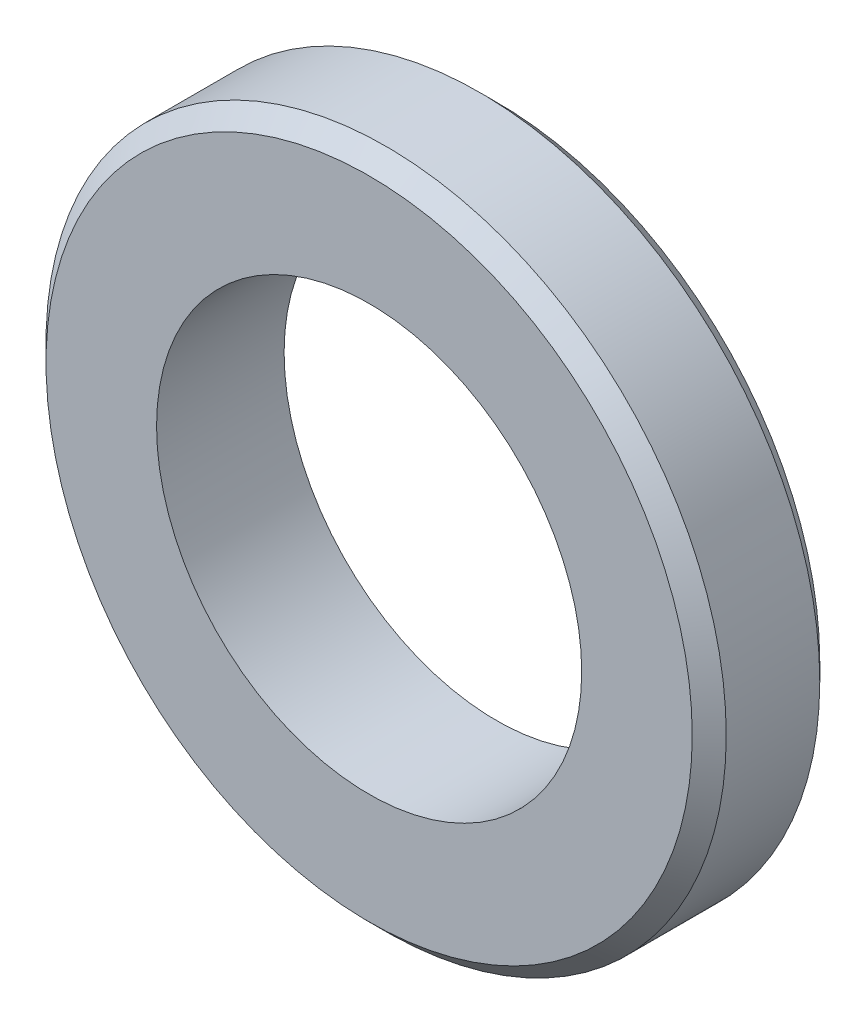
from build123d import *

# Parameters (mm, degrees)
SKETCH1_R           = 8
SKETCH1_R_2         = 5
BOSS_EXTRUDE1_DEPTH = 3
CHAMFER1_SIZE       = 0.4


with BuildPart() as part:
    # Sketch1 → Boss-Extrude1 (new body)
    with BuildSketch(Plane.XY):
        Circle(SKETCH1_R)
        Circle(SKETCH1_R_2, mode=Mode.SUBTRACT)
    extrude(amount=BOSS_EXTRUDE1_DEPTH)

    # Chamfer1
    chamfer1_edges = [part.edges().sort_by_distance(p)[0] for p in [
        (-8, 0, 0),
        (-8, 0, 3),
    ]]
    chamfer(chamfer1_edges, length=CHAMFER1_SIZE)


solid = part.part
